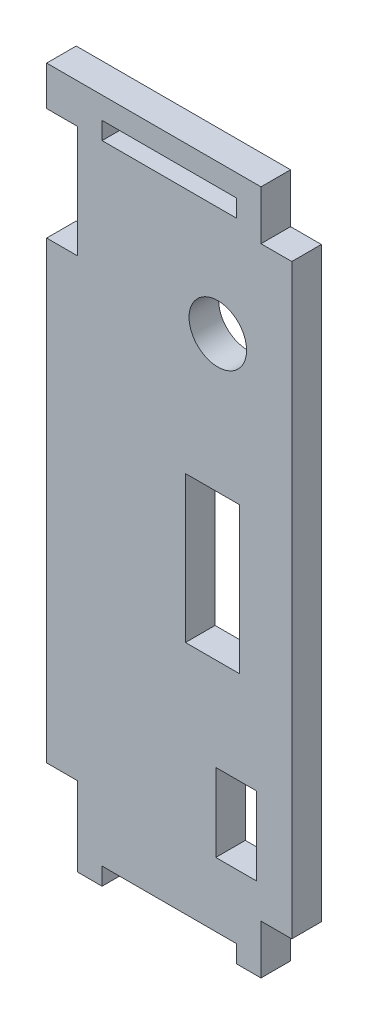
from build123d import *

# Parameters (mm, degrees)
SKETCH1_W           = 4.1783
SKETCH1_H           = 8.0391
SKETCH1_W_2         = 5.588
SKETCH1_H_2         = 15.0876
SKETCH1_W_3         = 13.843
SKETCH1_H_3         = 1.8034
SKETCH1_R           = 2.96545
BOSS_EXTRUDE1_DEPTH = 3.048


with BuildPart() as part:
    # Sketch1 → Boss-Extrude1 (new body)
    with BuildSketch(Plane.XY):
        Polygon((3.175, 64.77), (3.175, 53.213), (0, 53.213), (0, 6.35), (3.175, 6.35), (3.175, -1.8034), (5.715, -1.8034), (5.715, 0), (19.558, 0), (19.558, -1.8034), (22.098, -1.8034), (22.098, 3.2766), (25.273, 3.2766), (25.273, 63.754), (22.098, 63.754), (22.098, 68.834), (0, 68.834), (0, 64.77), align=None)
        with Locations((19.52625, 10.64895)):
            Rectangle(SKETCH1_W, SKETCH1_H, mode=Mode.SUBTRACT)
        with Locations((17.1069, 31.8008)):
            Rectangle(SKETCH1_W_2, SKETCH1_H_2, mode=Mode.SUBTRACT)
        with Locations((12.6365, 65.6717)):
            Rectangle(SKETCH1_W_3, SKETCH1_H_3, mode=Mode.SUBTRACT)
        with Locations(Location((17.64665, 53.48605, 0), (0, 0, 180))):
            Circle(SKETCH1_R, mode=Mode.SUBTRACT)
    extrude(amount=BOSS_EXTRUDE1_DEPTH)


solid = part.part
